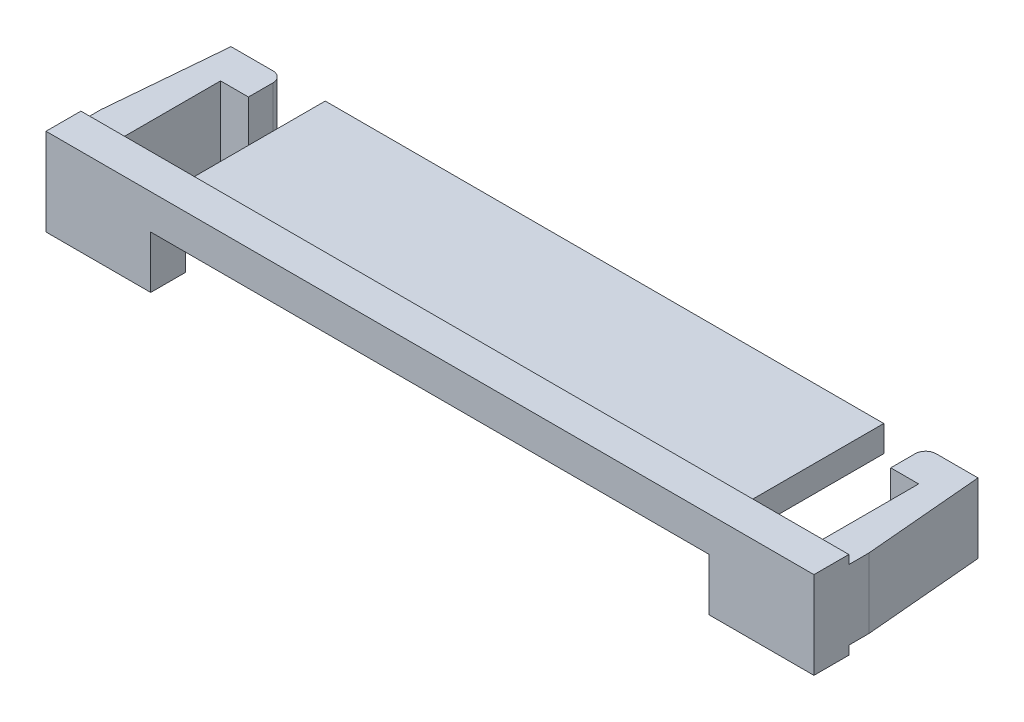
from build123d import *
from OCP.BRepFilletAPI import BRepFilletAPI_MakeChamfer

# Parameters (mm, degrees)
SKETCH1_W           = 22
SKETCH1_H           = 2.5
BOSS_EXTRUDE1_DEPTH = 5
SKETCH2_W           = 22
SKETCH2_H           = 0.25
CUT_EXTRUDE1_DEPTH  = 4
SKETCH3_W           = 2
SKETCH3_H           = 2
CUT_EXTRUDE2_DEPTH  = 4
SKETCH5_W           = 16
SKETCH5_H           = 1.5
CUT_EXTRUDE3_DEPTH  = 5
SKETCH6_W           = 1.8
SKETCH6_H           = 1
BOSS_EXTRUDE2_DEPTH = 2
FILLET1_R           = 0.3
CHAMFER1_SIZE       = 0.3
CHAMFER1_SIZE2      = 3.429015691


with BuildPart() as part:
    # Sketch1 → Boss-Extrude1 (new body)
    with BuildSketch(Plane.XY):
        Rectangle(SKETCH1_W, SKETCH1_H)
    extrude(amount=BOSS_EXTRUDE1_DEPTH)

    # Sketch2 → Cut-Extrude1 (cut)
    with BuildSketch(Plane(origin=(0, 0, 0), x_dir=(-1, 0, 0), z_dir=(0, 0, -1))):
        with Locations((0, 1.125)):
            Rectangle(SKETCH2_W, SKETCH2_H)
        with Locations((0, -1.125)):
            Rectangle(SKETCH2_W, SKETCH2_H)
    extrude(amount=-CUT_EXTRUDE1_DEPTH, mode=Mode.SUBTRACT)

    # Sketch3 → Cut-Extrude2 (cut)
    with BuildSketch(Plane(origin=(0, 0, 0), x_dir=(-1, 0, 0), z_dir=(0, 0, -1))):
        with Locations((-9, 0)):
            Rectangle(SKETCH3_W, SKETCH3_H)
        with Locations((9, 0)):
            Rectangle(SKETCH3_W, SKETCH3_H)
    extrude(amount=-CUT_EXTRUDE2_DEPTH, mode=Mode.SUBTRACT)

    # Sketch5 → Cut-Extrude3 (cut)
    with BuildSketch(Plane(origin=(0, 0, 0), x_dir=(-1, 0, 0), z_dir=(0, 0, -1))):
        with Locations((0, -0.5)):
            Rectangle(SKETCH5_W, SKETCH5_H)
    extrude(amount=-CUT_EXTRUDE3_DEPTH, mode=Mode.SUBTRACT)

    # Sketch6 → Boss-Extrude2 (add)
    with BuildSketch(Plane(origin=(0, 1, 0), x_dir=(1, 0, 0), z_dir=(0, 1, 0))):
        with Locations((-10.1, -0.5)):
            Rectangle(SKETCH6_W, SKETCH6_H)
        with Locations((10.1, -0.5)):
            Rectangle(SKETCH6_W, SKETCH6_H)
    extrude(amount=-BOSS_EXTRUDE2_DEPTH)

    # Fillet1
    fillet1_edges = [part.edges().sort_by_distance(p)[0] for p in [
        (-9.2, 0, 0),
        (9.2, 0, 0),
    ]]
    fillet(fillet1_edges, radius=FILLET1_R)

    # Chamfer1: one chamfer whose edges measure the first distance from different faces: ONE call of the kernel's chamfer builder (chamfer() names one face for all edges)
    chamfer1_edges_1 = [part.edges().sort_by_distance(p)[0] for p in [
        (11, 0, 0),
    ]]
    chamfer1_side_1 = [part.faces().sort_by_distance(p)[0] for p in [
        (10.25, 0, 0),
    ]]
    chamfer1_edges_2 = [part.edges().sort_by_distance(p)[0] for p in [
        (-11, 0, 0),
    ]]
    chamfer1_side_2 = [part.faces().sort_by_distance(p)[0] for p in [
        (-10.25, 0, 0),
    ]]
    chamfer1 = BRepFilletAPI_MakeChamfer(part.part.solid().wrapped)
    for e in chamfer1_edges_1:
        chamfer1.Add(CHAMFER1_SIZE, CHAMFER1_SIZE2, e.wrapped, chamfer1_side_1[0].wrapped)  # the first distance lies on this face
    for e in chamfer1_edges_2:
        chamfer1.Add(CHAMFER1_SIZE, CHAMFER1_SIZE2, e.wrapped, chamfer1_side_2[0].wrapped)  # the first distance lies on this face
    add(Compound.cast(chamfer1.Shape()), mode=Mode.REPLACE)


solid = part.part
